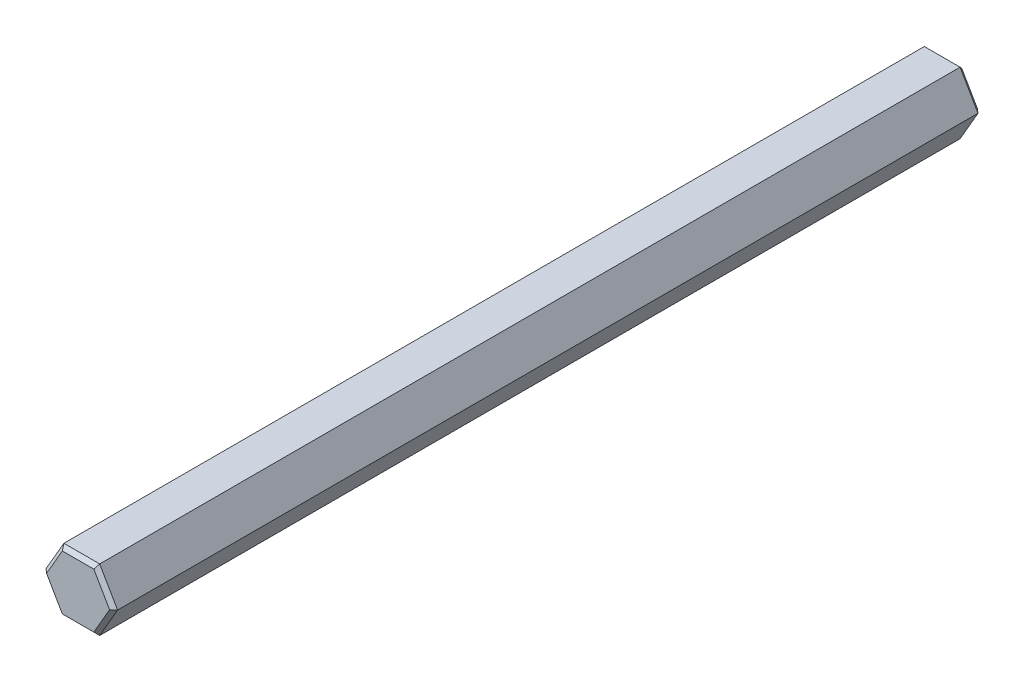
from build123d import *

# Parameters (mm, degrees)
BOSS_EXTRUDE1_DEPTH = 177.8
CHAMFER1_SIZE       = 0.762


with BuildPart() as part:
    # Sketch1 → Boss-Extrude1 (new body)
    with BuildSketch(Plane(origin=(0, 0, 0), x_dir=(-1, 0, 0), z_dir=(0, 0, -1))):
        Polygon((7.332348419, 0), (3.666174209, 6.35), (-3.666174209, 6.35), (-7.332348419, 0), (-3.666174209, -6.35), (3.666174209, -6.35), align=None)
    extrude(amount=-BOSS_EXTRUDE1_DEPTH)

    # Chamfer1
    chamfer1_edges = [part.edges().sort_by_distance(p)[0] for p in [
        (0, 6.35, 177.8),
        (5.499261314, 3.175, 177.8),
        (5.499261314, -3.175, 177.8),
        (0, -6.35, 177.8),
        (-5.499261314, -3.175, 177.8),
        (0, -6.35, 0),
        (5.499261314, -3.175, 0),
        (5.499261314, 3.175, 0),
        (-5.499261314, 3.175, 177.8),
        (0, 6.35, 0),
        (-5.499261314, 3.175, 0),
        (-5.499261314, -3.175, 0),
    ]]
    chamfer(chamfer1_edges, length=CHAMFER1_SIZE)


solid = part.part
